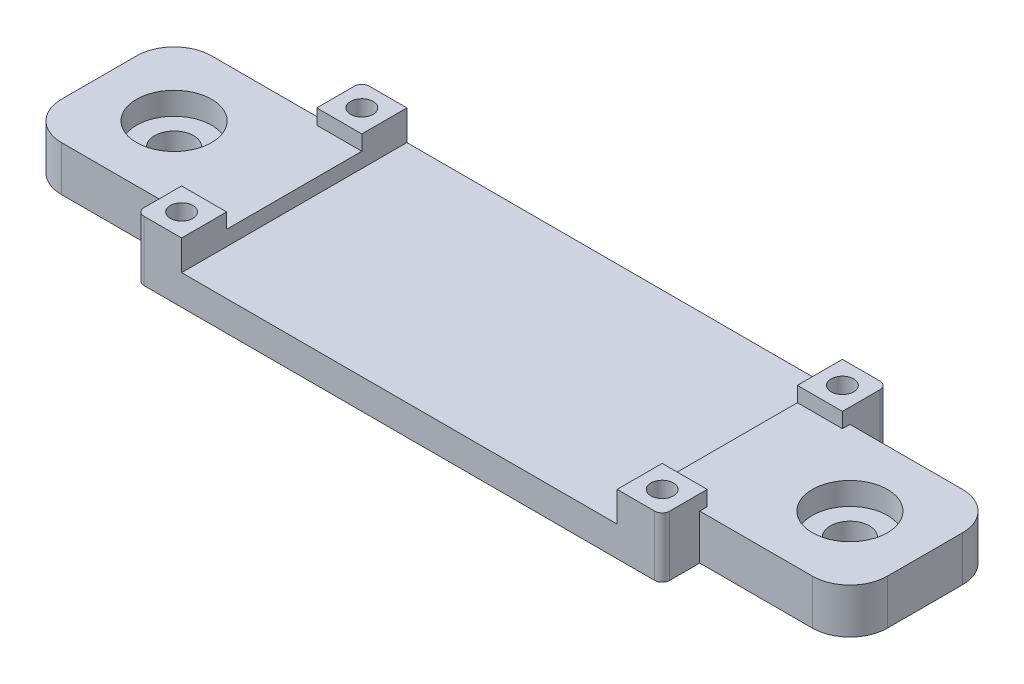
from build123d import *

# Parameters (mm, degrees)
SKETCH_25_W          = 70
SKETCH_25_H          = 30
SKETCH_25_R          = 1.5
EXTRUDE_9_DEPTH      = 4
SKETCH_26_W          = 6
SKETCH_26_H          = 6
SKETCH_26_R          = 1.5
EXTRUDE_10_DEPTH     = 4
FILLET_3_R           = 1
EXTRUDE_11_DEPTH     = 6
SKETCH_28_W          = 6
SKETCH_28_H          = 18
EXTRUDE_12_DEPTH     = 2
SKETCH_29_R          = 5
CUT_EXTRUDE_15_DEPTH = 3
FILLET_4_R           = 5


with BuildPart() as part:
    # 草图25 → 凸台-拉伸9 (new body)
    with BuildSketch(Plane(origin=(0, 0, 0), x_dir=(1, 0, 0), z_dir=(0, 1, 0))):
        Rectangle(SKETCH_25_W, SKETCH_25_H)
        with Locations(Location((-32, 12, 0), (0, 0, 270))):
            Circle(SKETCH_25_R, mode=Mode.SUBTRACT)
        with Locations(Location((32, 12, 0), (0, 0, 270))):
            Circle(SKETCH_25_R, mode=Mode.SUBTRACT)
        with Locations(Location((32, -12, 0), (0, 0, 270))):
            Circle(SKETCH_25_R, mode=Mode.SUBTRACT)
        with Locations(Location((-32, -12, 0), (0, 0, 270))):
            Circle(SKETCH_25_R, mode=Mode.SUBTRACT)
    extrude(amount=EXTRUDE_9_DEPTH)

    # 草图26 → 凸台-拉伸10 (add)
    # profile 1 of 4: a face of its own
    with BuildSketch(Plane(origin=(0, 4, 0), x_dir=(1, 0, 0), z_dir=(0, 1, 0))):
        with Locations((-32, 12)):
            Rectangle(SKETCH_26_W, SKETCH_26_H)
        with Locations(Location((-32, 12, 0), (0, 0, 270))):
            Circle(SKETCH_26_R, mode=Mode.SUBTRACT)
    # profile 2 of 4: a face of its own
    with BuildSketch(Plane(origin=(0, 4, 0), x_dir=(1, 0, 0), z_dir=(0, 1, 0))):
        with Locations((-32, -12)):
            Rectangle(SKETCH_26_W, SKETCH_26_H)
        with Locations(Location((-32, -12, 0), (0, 0, 270))):
            Circle(SKETCH_26_R, mode=Mode.SUBTRACT)
    # profile 3 of 4: a face of its own
    with BuildSketch(Plane(origin=(0, 4, 0), x_dir=(1, 0, 0), z_dir=(0, 1, 0))):
        with Locations((32, -12)):
            Rectangle(SKETCH_26_W, SKETCH_26_H)
        with Locations(Location((32, -12, 0), (0, 0, 270))):
            Circle(SKETCH_26_R, mode=Mode.SUBTRACT)
    # profile 4 of 4: a face of its own
    with BuildSketch(Plane(origin=(0, 4, 0), x_dir=(1, 0, 0), z_dir=(0, 1, 0))):
        with Locations((32, 12)):
            Rectangle(SKETCH_26_W, SKETCH_26_H)
        with Locations(Location((32, 12, 0), (0, 0, 270))):
            Circle(SKETCH_26_R, mode=Mode.SUBTRACT)
    extrude(amount=EXTRUDE_10_DEPTH)

    # 圆角3
    fillet_3_edges = [part.edges().sort_by_distance(p)[0] for p in [
        (-35, 4, -15),
        (35, 4, -15),
        (35, 4, 15),
        (-35, 4, 15),
    ]]
    fillet(fillet_3_edges, radius=FILLET_3_R)

    # 草图27 → 凸台-拉伸11 (add)
    with BuildSketch(Plane.XZ):
        with BuildLine():
            Line((-42.4, 0), (-35, 0))
            Line((-35, 0), (-35, 10))
            Line((-35, 10), (-55, 10))
            Line((-55, 10), (-55, 0))
            Line((-55, 0), (-47.6, 0))
            ThreePointArc((-47.6, 0), (-45, 2.6), (-42.4, 0))
        make_face()
        with BuildLine():
            Line((-35, -10), (-35, 0))
            Line((-35, 0), (-42.4, 0))
            ThreePointArc((-42.4, 0), (-45, -2.6), (-47.6, 0))
            Line((-47.6, 0), (-55, 0))
            Line((-55, 0), (-55, -10))
            Line((-55, -10), (-35, -10))
        make_face()
        with BuildLine():
            ThreePointArc((42.4, 0), (45, 2.6), (47.6, 0))
            Line((47.6, 0), (55, 0))
            Line((55, 0), (55, 10))
            Line((55, 10), (35, 10))
            Line((35, 10), (35, 0))
            Line((35, 0), (42.4, 0))
        make_face()
        with BuildLine():
            Line((55, 0), (47.6, 0))
            ThreePointArc((47.6, 0), (45, -2.6), (42.4, 0))
            Line((42.4, 0), (35, 0))
            Line((35, 0), (35, -10))
            Line((35, -10), (55, -10))
            Line((55, -10), (55, 0))
        make_face()
    extrude(amount=-EXTRUDE_11_DEPTH)

    # 草图28 → 凸台-拉伸12 (add)
    with BuildSketch(Plane(origin=(0, 4, 0), x_dir=(1, 0, 0), z_dir=(0, 1, 0))):
        with Locations((-32, 0)):
            Rectangle(SKETCH_28_W, SKETCH_28_H)
        with Locations((32, 0)):
            Rectangle(SKETCH_28_W, SKETCH_28_H)
    extrude(amount=EXTRUDE_12_DEPTH)

    # 草图29 → 切除-拉伸15 (cut)
    with BuildSketch(Plane(origin=(0, 6, 0), x_dir=(1, 0, 0), z_dir=(0, 1, 0))):
        with Locations(Location((-45, 0, 0), (0, 0, 270))):
            Circle(SKETCH_29_R)
        with Locations(Location((45, 0, 0), (0, 0, 270))):
            Circle(SKETCH_29_R)
    extrude(amount=-CUT_EXTRUDE_15_DEPTH, mode=Mode.SUBTRACT)

    # 圆角4
    fillet_4_edges = [part.edges().sort_by_distance(p)[0] for p in [
        (-55, 3, -10),
        (-55, 3, 10),
        (55, 3, -10),
        (55, 3, 10),
    ]]
    fillet(fillet_4_edges, radius=FILLET_4_R)


solid = part.part
